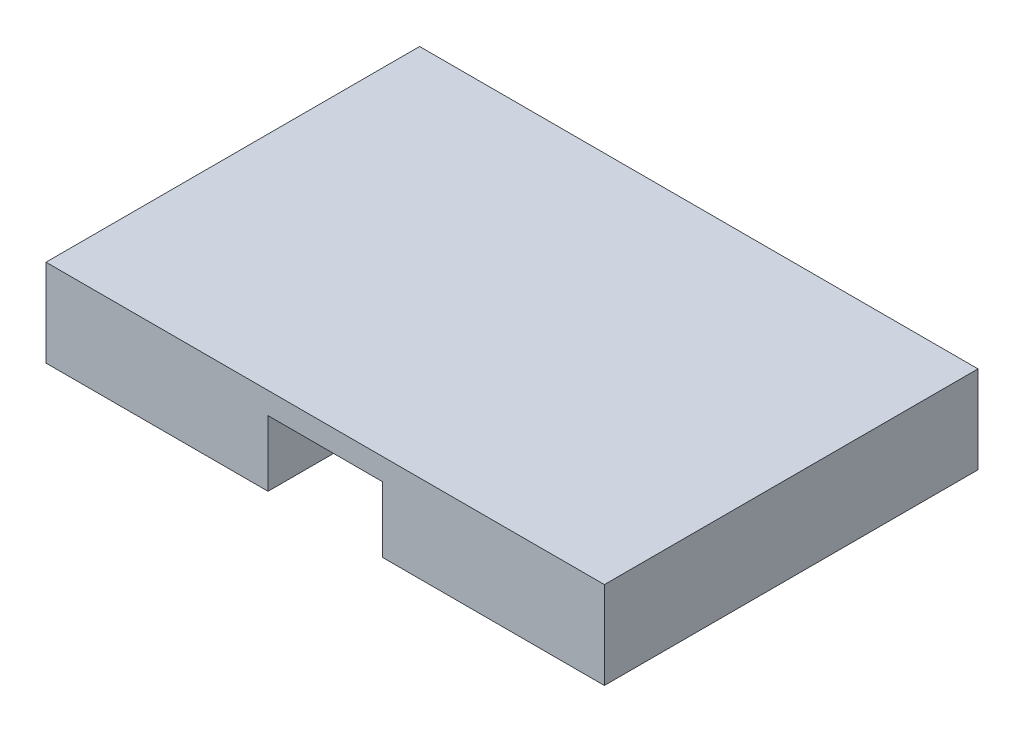
from build123d import *

# Parameters (mm, degrees)
SKETCH1_W           = 127.76
SKETCH1_H           = 85.48
BOSS_EXTRUDE1_DEPTH = 20
CUT_EXTRUDE1_START  = -5
CUT_EXTRUDE1_DEPTH  = 20


with BuildPart() as part:
    # Sketch1 → Boss-Extrude1 (new body)
    with BuildSketch(Plane(origin=(0, 0, 0), x_dir=(1, 0, 0), z_dir=(0, 1, 0))):
        with Locations((63.88, 42.74)):
            Rectangle(SKETCH1_W, SKETCH1_H)
    extrude(amount=BOSS_EXTRUDE1_DEPTH)

    # Sketch2 → Cut-Extrude1 (cut)
    with BuildSketch(Plane(origin=(0, 20, 0), x_dir=(1, 0, 0), z_dir=(0, 1, 0)).offset(CUT_EXTRUDE1_START)):
        Polygon((76.96, 85.48), (50.8, 85.48), (50.8, 12.7), (50.8, 0), (76.96, 0), (76.96, 72.78), align=None)
    extrude(amount=-CUT_EXTRUDE1_DEPTH, mode=Mode.SUBTRACT)


solid = part.part
